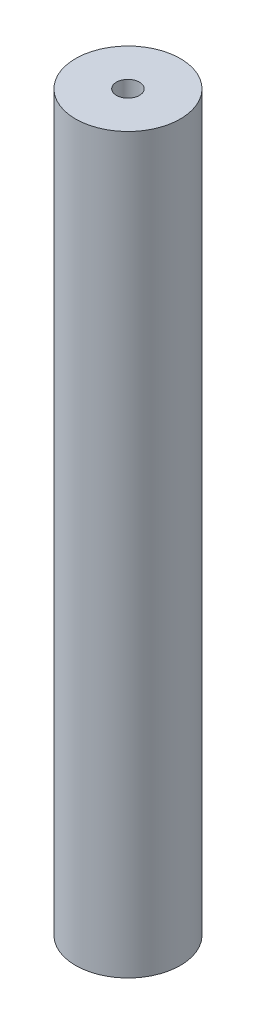
from build123d import *

# Parameters (mm, degrees)
SKETCH_1_R      = 7.5
EXTRUDE_1_DEPTH = 105


with BuildPart() as part:
    # ｽｹｯﾁ1 → ﾎﾞｽ - 押し出し1 (new body)
    with BuildSketch(Plane(origin=(0, 0, 0), x_dir=(1, 0, 0), z_dir=(0, 1, 0))):
        with Locations(Location((0, 0, 0), (0, 0, 270))):
            Circle(SKETCH_1_R)
    extrude(amount=EXTRUDE_1_DEPTH)

    # ｽｹｯﾁ3 → M4x0.7 ねじ穴1 (revolve, cut)
    with BuildSketch(Plane(origin=(0, 105, 0), x_dir=(0, 0, 1), z_dir=(1, 0, 0))):
        Polygon((0, 0), (0, 20.991420021), (1.65, 20), (1.65, 0), align=None)
    m4x0_7_1 = revolve(axis=Axis((0, 111.35, 0), (0, -1, 0)), mode=Mode.SUBTRACT)

    # ﾐﾗｰ1: M4x0.7 ねじ穴1 across plane
    add(m4x0_7_1.mirror(Plane.ZX.offset(52.5)), mode=Mode.SUBTRACT)


solid = part.part
